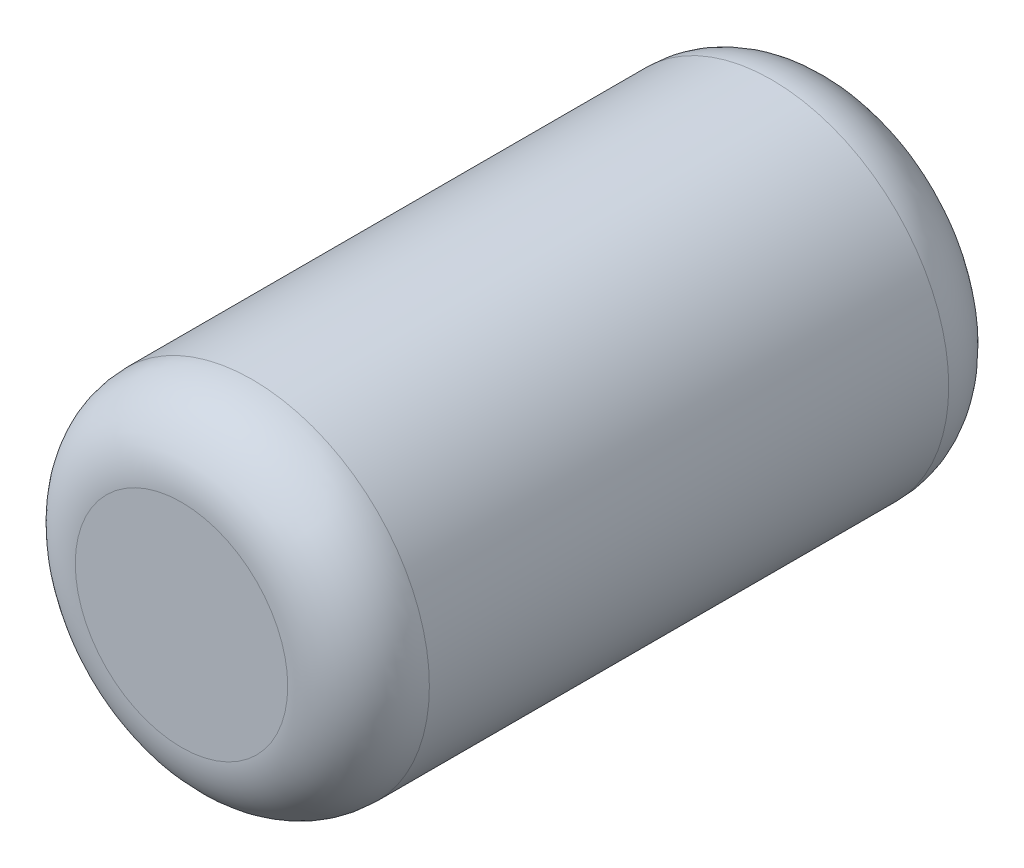
from build123d import *

# Parameters (mm, degrees)
SKETCH2_R           = 7.5
BOSS_EXTRUDE1_DEPTH = 28
FILLET1_R           = 3


with BuildPart() as part:
    # Sketch2 → Boss-Extrude1 (new body)
    with BuildSketch(Plane.XY):
        Circle(SKETCH2_R)
    extrude(amount=BOSS_EXTRUDE1_DEPTH)

    # Fillet1
    fillet1_edges = [part.edges().sort_by_distance(p)[0] for p in [
        (-7.5, 0, 0),
        (-7.5, 0, 28),
    ]]
    fillet(fillet1_edges, radius=FILLET1_R)


solid = part.part
